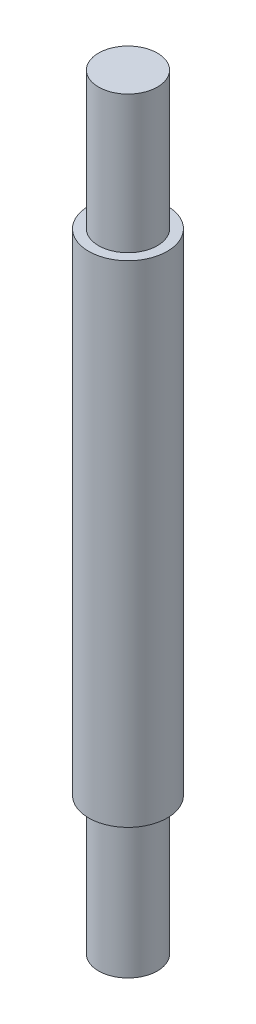
from build123d import *

# Parameters (mm, degrees)
SKETCH1_R           = 2
BOSS_EXTRUDE1_DEPTH = 25
SKETCH2_R           = 1.5
BOSS_EXTRUDE2_DEPTH = 7
BOSS_EXTRUDE3_START = 7
SKETCH3_R           = 1.5
BOSS_EXTRUDE3_DEPTH = 7


with BuildPart() as part:
    # Sketch1 → Boss-Extrude1 (new body)
    with BuildSketch(Plane(origin=(0, 0, 0), x_dir=(1, 0, 0), z_dir=(0, 1, 0))):
        with Locations(Location((0, 0, 0), (0, 0, 270))):
            Circle(SKETCH1_R)
    extrude(amount=BOSS_EXTRUDE1_DEPTH)

    # Sketch2 → Boss-Extrude2 (add)
    with BuildSketch(Plane(origin=(0, 25, 0), x_dir=(1, 0, 0), z_dir=(0, 1, 0))):
        with Locations(Location((0, 0, 0), (0, 0, 270))):
            Circle(SKETCH2_R)
    extrude(amount=BOSS_EXTRUDE2_DEPTH)

    # Sketch3 → Boss-Extrude3 (add)
    with BuildSketch(Plane.XZ.offset(BOSS_EXTRUDE3_START)):
        with Locations(Location((0, 0, 0), (0, 0, 90))):
            Circle(SKETCH3_R)
    extrude(amount=-BOSS_EXTRUDE3_DEPTH)


solid = part.part
